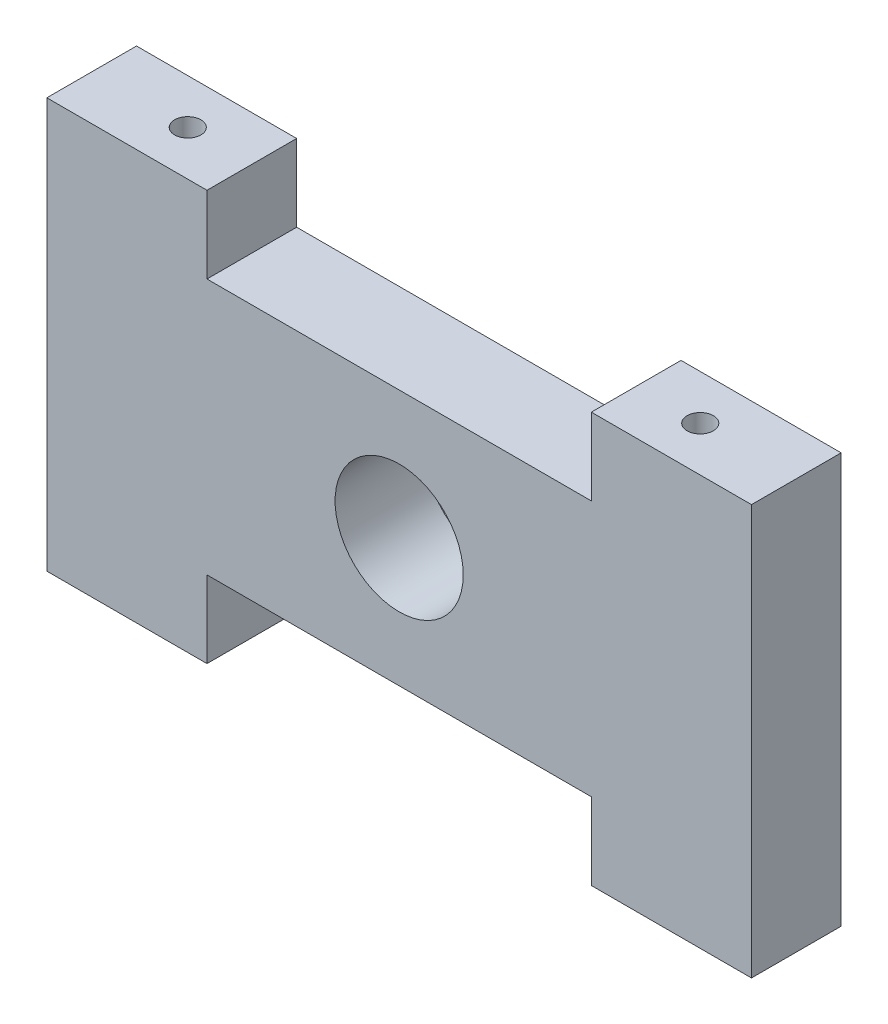
from build123d import *

# Parameters (mm, degrees)
SKETCH1_R                = 5
BOSS_EXTRUDE1_DEPTH      = 7
M2_5X0_45_TAPPED_HOLE1_D = 2.05


with BuildPart() as part:
    # Sketch1 → Boss-Extrude1 (new body)
    with BuildSketch(Plane.XY):
        Polygon((-15, 10), (-15, 16), (-27.5, 16), (-27.5, -16), (-15, -16), (-15, -10), (15, -10), (15, -16), (27.5, -16), (27.5, 16), (15, 16), (15, 10), align=None)
        Circle(SKETCH1_R, mode=Mode.SUBTRACT)
    extrude(amount=BOSS_EXTRUDE1_DEPTH)

    # M2.5x0.45 Tapped Hole1 (through all)
    with Locations(Plane(origin=(0, 16, 0), x_dir=(-1, 0, 0), z_dir=(0, 1, 0))):
        with Locations((20, 3.5), (-20, 3.5)):
            Hole(M2_5X0_45_TAPPED_HOLE1_D / 2)


solid = part.part
